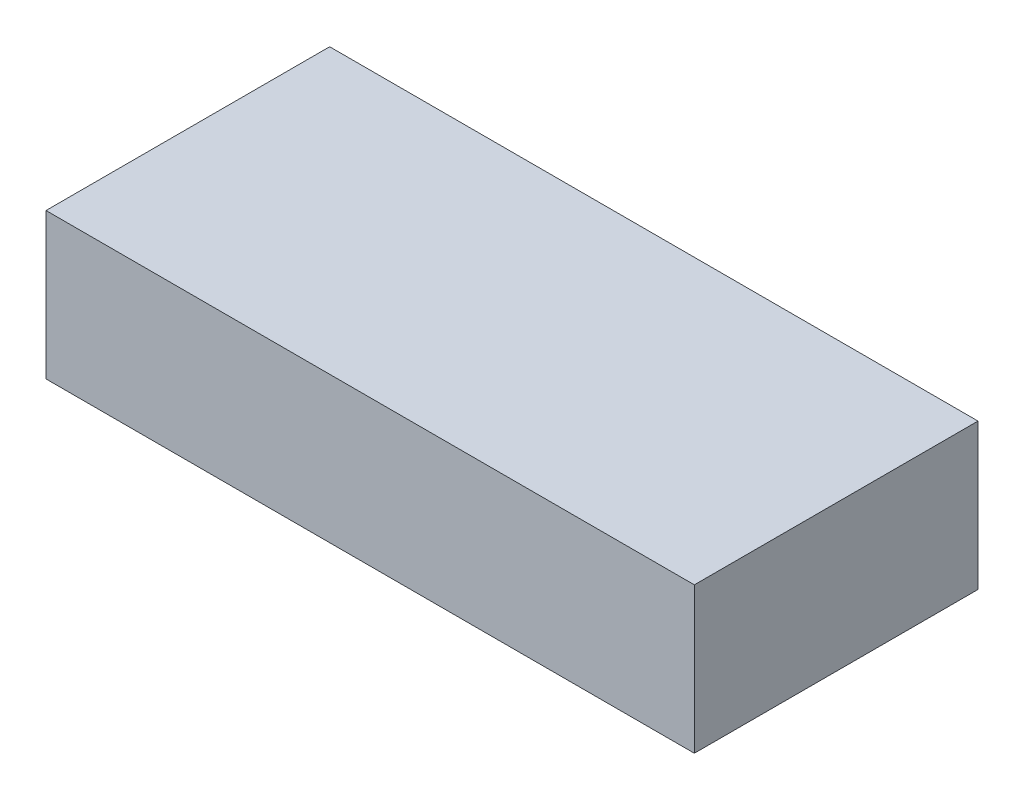
from build123d import *

# Parameters (mm, degrees)
SKETCH_1_W      = 80
SKETCH_1_H      = 35
EXTRUDE_1_DEPTH = 18


with BuildPart() as part:
    # 草图1 → 凸台-拉伸1 (new body)
    with BuildSketch(Plane(origin=(0, 0, 0), x_dir=(1, 0, 0), z_dir=(0, 1, 0))):
        Rectangle(SKETCH_1_W, SKETCH_1_H)
    extrude(amount=EXTRUDE_1_DEPTH)


solid = part.part
